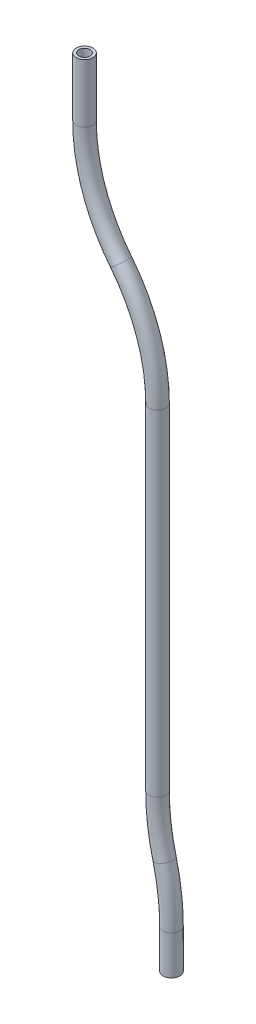
from build123d import *

# Parameters (mm, degrees)
SKETCH_1_R      = 3
SKETCH_1_R_2    = 2
EXTRUDE_1_DEPTH = 15
SKETCH_1_2_R    = 3
SKETCH_1_2_R_2  = 2


with BuildPart() as part:
    # Эскиз1 → Бобышка-Вытянуть1 (new body)
    with BuildSketch(Plane(origin=(0, 0, 0), x_dir=(1, 0, 0), z_dir=(0, 1, 0))):
        Circle(SKETCH_1_R)
        Circle(SKETCH_1_R_2, mode=Mode.SUBTRACT)
    extrude(amount=EXTRUDE_1_DEPTH)

    # По траектории1: sweep along a path in Sketch 296
    with BuildLine(Plane.XY) as sweep_1_path:
        Line((0, 0), (0, -6))
        ThreePointArc((0, -6), (3.369619461, -25.824227602), (13.1, -43.421785099))
        ThreePointArc((13.1, -43.421785099), (22.830380539, -61.019342597), (26.2, -80.843570198))
        Line((26.2, -80.843570198), (26.2, -201.157300532))
        ThreePointArc((26.2, -201.157300532), (26.827460668, -211.157300532), (28.7, -221.000435365))
        ThreePointArc((28.7, -221.000435365), (30.572539332, -230.843570198), (31.2, -240.843570198))
        Line((31.2, -240.843570198), (31.2, -254.843570198))
    # Эскиз1<2> → По траектории1 (sweep)
    with BuildSketch(Plane(origin=(0, 0, 0), x_dir=(1, 0, 0), z_dir=(0, 1, 0))):
        Circle(SKETCH_1_2_R)
        Circle(SKETCH_1_2_R_2, mode=Mode.SUBTRACT)
    sweep(path=sweep_1_path.line)


solid = part.part
